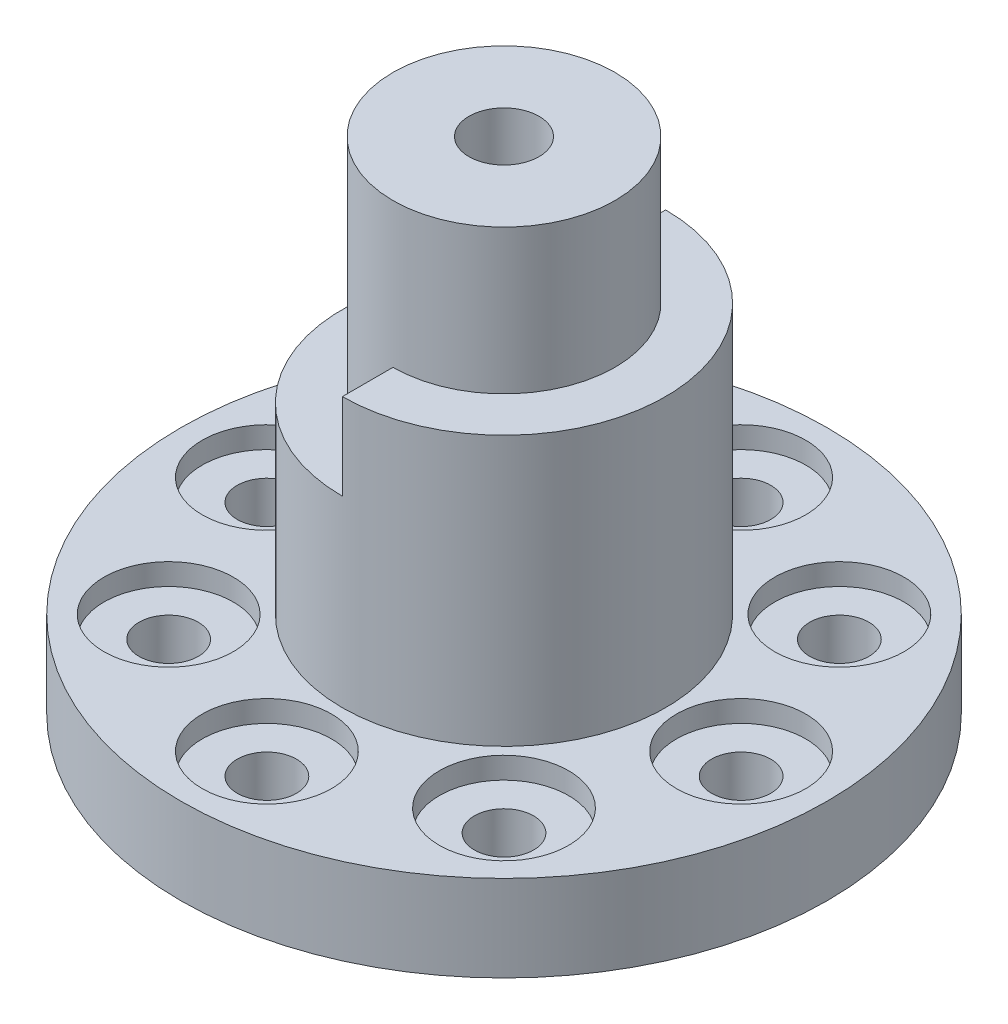
from build123d import *

# Parameters (mm, degrees)
SKETCH1_R           = 7.5
BOSS_EXTRUDE1_DEPTH = 5
SKETCH1_3_R         = 5.15
BOSS_EXTRUDE2_DEPTH = 15.7
BOSS_EXTRUDE3_DEPTH = 4
SKETCH3_R           = 1.625
CUT_EXTRUDE1_DEPTH  = 37
SKETCH4_R           = 3.5
CUT_EXTRUDE2_DEPTH  = 10.7
BOSS_EXTRUDE4_START = 3.5
SKETCH5_R           = 7.5
SKETCH5_R_2         = 3.5
BOSS_EXTRUDE4_DEPTH = 3.5
BOSS_EXTRUDE5_START = 4
SKETCH6_R           = 15
SKETCH6_R_2         = 1.375
SKETCH6_R_3         = 3.5
BOSS_EXTRUDE5_DEPTH = 4
SKETCH7_R           = 3
CUT_EXTRUDE3_DEPTH  = 1
CUT_EXTRUDE4_START  = -12.5
SKETCH8_R           = 7.5
SKETCH8_R_2         = 7.45
CUT_EXTRUDE4_DEPTH  = 12.5
BOSS_EXTRUDE6_START = -8.5
SKETCH9_R           = 7.5
SKETCH9_R_2         = 7.45
BOSS_EXTRUDE6_DEPTH = 8.5
BOSS_EXTRUDE7_DEPTH = 4


with BuildPart() as part:
    # Sketch1 → Boss-Extrude1 (new body)
    with BuildSketch(Plane(origin=(0, 0, 0), x_dir=(1, 0, 0), z_dir=(0, 1, 0))):
        Circle(SKETCH1_R)
    extrude(amount=BOSS_EXTRUDE1_DEPTH)

    # Sketch1<3> → Boss-Extrude2 (add)
    with BuildSketch(Plane(origin=(0, 0, 0), x_dir=(1, 0, 0), z_dir=(0, 1, 0))):
        Circle(SKETCH1_3_R)
    extrude(amount=BOSS_EXTRUDE2_DEPTH)

    # Sketch2 → Boss-Extrude3 (add)
    with BuildSketch(Plane(origin=(0, 5, 0), x_dir=(1, 0, 0), z_dir=(0, 1, 0))):
        with BuildLine():
            ThreePointArc((7.5, 0), (5.303300859, 5.303300859), (0, 7.5))
            Line((0, 7.5), (0, 5.15))
            ThreePointArc((0, 5.15), (3.641599923, 3.641599923), (5.15, 0))
            ThreePointArc((5.15, 0), (3.641599923, -3.641599923), (0, -5.15))
            Line((0, -5.15), (0, -7.5))
            ThreePointArc((0, -7.5), (5.303300859, -5.303300859), (7.5, 0))
        make_face()
    extrude(amount=BOSS_EXTRUDE3_DEPTH)

    # Sketch3 → Cut-Extrude1 (cut)
    with BuildSketch(Plane.XZ):
        Circle(SKETCH3_R)
    extrude(amount=-CUT_EXTRUDE1_DEPTH, mode=Mode.SUBTRACT)

    # Sketch4 → Cut-Extrude2 (cut)
    with BuildSketch(Plane.XZ):
        Circle(SKETCH4_R)
    extrude(amount=-CUT_EXTRUDE2_DEPTH, mode=Mode.SUBTRACT)

    # Sketch5 → Boss-Extrude4 (add)
    with BuildSketch(Plane.XZ.offset(BOSS_EXTRUDE4_START)):
        Circle(SKETCH5_R)
        Circle(SKETCH5_R_2, mode=Mode.SUBTRACT)
    extrude(amount=-BOSS_EXTRUDE4_DEPTH)

    # Sketch6 → Boss-Extrude5 (add)
    with BuildSketch(Plane.XZ.offset(3.5).offset(BOSS_EXTRUDE5_START)):
        Circle(SKETCH6_R)
        with Locations((11, 0)):
            Circle(SKETCH6_R_2, mode=Mode.SUBTRACT)
        with Locations((7.778174593, -7.778174593)):
            Circle(SKETCH6_R_2, mode=Mode.SUBTRACT)
        with Locations((0, -11)):
            Circle(SKETCH6_R_2, mode=Mode.SUBTRACT)
        with Locations((-7.778174593, -7.778174593)):
            Circle(SKETCH6_R_2, mode=Mode.SUBTRACT)
        with Locations((-11, 0)):
            Circle(SKETCH6_R_2, mode=Mode.SUBTRACT)
        with Locations((-7.778174593, 7.778174593)):
            Circle(SKETCH6_R_2, mode=Mode.SUBTRACT)
        with Locations((0, 11)):
            Circle(SKETCH6_R_2, mode=Mode.SUBTRACT)
        with Locations((7.778174593, 7.778174593)):
            Circle(SKETCH6_R_2, mode=Mode.SUBTRACT)
        Circle(SKETCH6_R_3, mode=Mode.SUBTRACT)
    extrude(amount=-BOSS_EXTRUDE5_DEPTH)

    # Sketch7 → Cut-Extrude3 (cut)
    with BuildSketch(Plane(origin=(0, -3.5, 0), x_dir=(1, 0, 0), z_dir=(0, 1, 0))):
        with Locations((-11, 0)):
            Circle(SKETCH7_R)
        with Locations((-7.778174593, 7.778174593)):
            Circle(SKETCH7_R)
        with Locations((0, 11)):
            Circle(SKETCH7_R)
        with Locations((7.778174593, 7.778174593)):
            Circle(SKETCH7_R)
        with Locations((11, 0)):
            Circle(SKETCH7_R)
        with Locations((7.778174593, -7.778174593)):
            Circle(SKETCH7_R)
        with Locations((0, -11)):
            Circle(SKETCH7_R)
        with Locations((-7.778174593, -7.778174593)):
            Circle(SKETCH7_R)
    extrude(amount=-CUT_EXTRUDE3_DEPTH, mode=Mode.SUBTRACT)

    # Sketch8 → Cut-Extrude4 (cut)
    with BuildSketch(Plane(origin=(0, 9, 0), x_dir=(1, 0, 0), z_dir=(0, 1, 0)).offset(CUT_EXTRUDE4_START)):
        Circle(SKETCH8_R)
        Circle(SKETCH8_R_2, mode=Mode.SUBTRACT)
    extrude(amount=CUT_EXTRUDE4_DEPTH, mode=Mode.SUBTRACT)

    # Sketch9 → Boss-Extrude6 (add)
    with BuildSketch(Plane(origin=(0, 5, 0), x_dir=(1, 0, 0), z_dir=(0, 1, 0)).offset(BOSS_EXTRUDE6_START)):
        Circle(SKETCH9_R)
        Circle(SKETCH9_R_2, mode=Mode.SUBTRACT)
    extrude(amount=BOSS_EXTRUDE6_DEPTH)

    # Sketch10 → Boss-Extrude7 (add)
    with BuildSketch(Plane(origin=(0, 5, 0), x_dir=(1, 0, 0), z_dir=(0, 1, 0))):
        with BuildLine():
            ThreePointArc((7.5, 0), (5.303300859, 5.303300859), (0, 7.5))
            Line((0, 7.5), (0, 7.45))
            ThreePointArc((0, 7.45), (5.26794552, 5.26794552), (7.45, 0))
            ThreePointArc((7.45, 0), (5.26794552, -5.26794552), (0, -7.45))
            Line((0, -7.45), (0, -7.5))
            ThreePointArc((0, -7.5), (5.303300859, -5.303300859), (7.5, 0))
        make_face()
    extrude(amount=BOSS_EXTRUDE7_DEPTH)


solid = part.part
